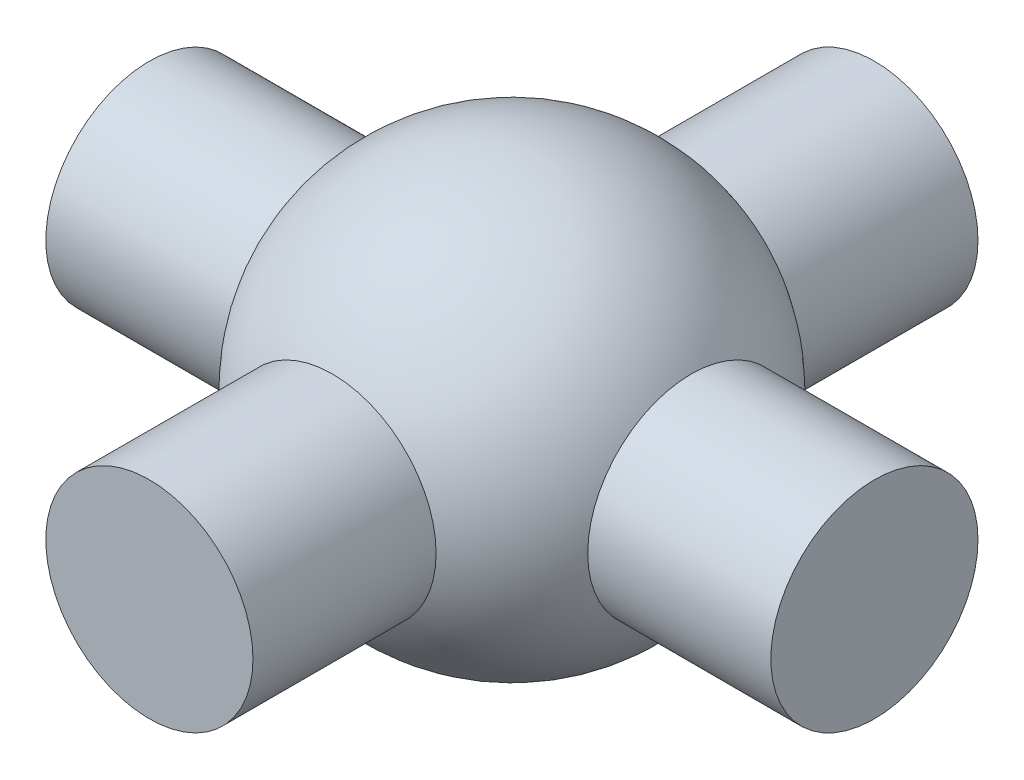
from build123d import *

# Parameters (mm, degrees)
SKETCH2_R           = 10
BOSS_EXTRUDE1_DEPTH = 35
SKETCH3_R           = 10
BOSS_EXTRUDE2_DEPTH = 35


with BuildPart() as part:
    # Sketch1 → Revolve1 (revolve)
    with BuildSketch(Plane(origin=(0, 0, 0), x_dir=(1, 0, 0), z_dir=(0, 1, 0))):
        with BuildLine():
            Line((0, 20), (0, -20))
            ThreePointArc((0, -20), (-20, 0), (0, 20))
        make_face()
    revolve(axis=Axis((0, 0, -20), (0, 0, 1)))



with BuildPart() as body_2:
    # Sketch2 → Boss-Extrude1 (new, symmetric)
    with BuildSketch(Plane.XY):
        Circle(SKETCH2_R)
    extrude(amount=BOSS_EXTRUDE1_DEPTH, both=True)


with BuildPart() as part_1:
    add(part.part)

    add(body_2.part)  # Boss-Extrude2 merges body 2
    # Sketch3 → Boss-Extrude2 (add, symmetric)
    with BuildSketch(Plane(origin=(0, 0, 0), x_dir=(0, 0, -1), z_dir=(1, 0, 0))):
        Circle(SKETCH3_R)
    extrude(amount=BOSS_EXTRUDE2_DEPTH, both=True)


solid = part_1.part
